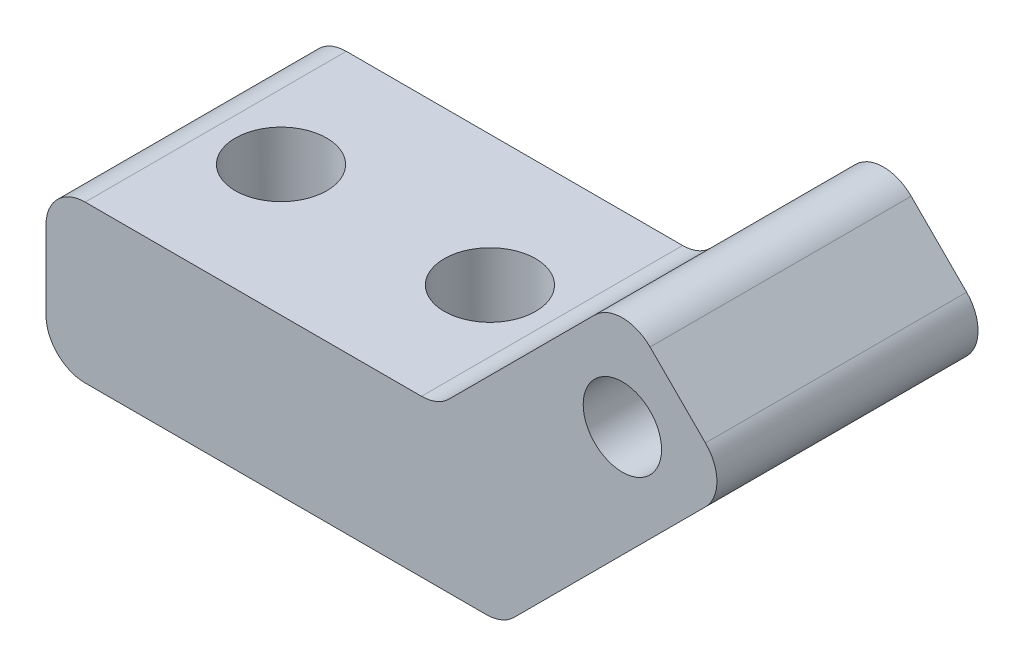
from build123d import *

# Parameters (mm, degrees)
ESQUISSE1_W                  = 30
ESQUISSE1_H                  = 12
BOSS_EXTRU_1_DEPTH           = 20
BOSS_EXTRU_2_DEPTH           = 20
ENL_V_MAT_EXTRU_1_DEPTH      = 59.048643566
ENL_V_MAT_EXTRU_1_DEPTH_BACK = 59.048643566
ESQUISSE3_R                  = 3.5
ENL_V_MAT_EXTRU_2_DEPTH      = 63.072991509
ENL_V_MAT_EXTRU_2_DEPTH_BACK = 63.072991509
ESQUISSE4_R                  = 3
CONG_1_R                     = 3


with BuildPart() as part:
    # Esquisse1 → Boss.-Extru.1 (new body)
    with BuildSketch(Plane.XY):
        with Locations((15, 6)):
            Rectangle(ESQUISSE1_W, ESQUISSE1_H)
    extrude(amount=BOSS_EXTRU_1_DEPTH)

    # Esquisse2 → Boss.-Extru.2 (add)
    with BuildSketch(Plane.XY.offset(20)):
        Polygon((30, 0), (34.970562748, 0), (52.627416998, 17.656854249), (44.142135624, 26.142135624), (30, 12), align=None)
    extrude(amount=-BOSS_EXTRU_2_DEPTH)

    # Esquisse3 → Enlèv. mat.-Extru.1 (cut, two sides: drawn at the far end of the back side and taken through both)
    with BuildSketch(Plane(origin=(0, 12, 0), x_dir=(1, 0, 0), z_dir=(0, 1, 0)).offset(-ENL_V_MAT_EXTRU_1_DEPTH_BACK)):
        with Locations(Location((8, -10, 0), (0, 0, 270))):
            Circle(ESQUISSE3_R)
        with Locations(Location((24, -10, 0), (0, 0, 270))):
            Circle(ESQUISSE3_R)
    extrude(amount=ENL_V_MAT_EXTRU_1_DEPTH + ENL_V_MAT_EXTRU_1_DEPTH_BACK, mode=Mode.SUBTRACT)

    # Esquisse4 → Enlèv. mat.-Extru.2 (cut, two sides: drawn at the far end of the back side and taken through both)
    with BuildSketch(Plane.XY.offset(20).offset(-ENL_V_MAT_EXTRU_2_DEPTH_BACK)):
        with Locations((44.142135624, 17.656854249)):
            Circle(ESQUISSE4_R)
    extrude(amount=ENL_V_MAT_EXTRU_2_DEPTH + ENL_V_MAT_EXTRU_2_DEPTH_BACK, mode=Mode.SUBTRACT)

    # Congé1
    cong_1_edges = [part.edges().sort_by_distance(p)[0] for p in [
        (44.142135624, 26.142135624, 10),
        (52.627416998, 17.656854249, 10),
        (34.970562748, 0, 10),
        (0, 12, 10),
        (30, 12, 10),
        (0, 0, 10),
    ]]
    fillet(cong_1_edges, radius=CONG_1_R)


solid = part.part
